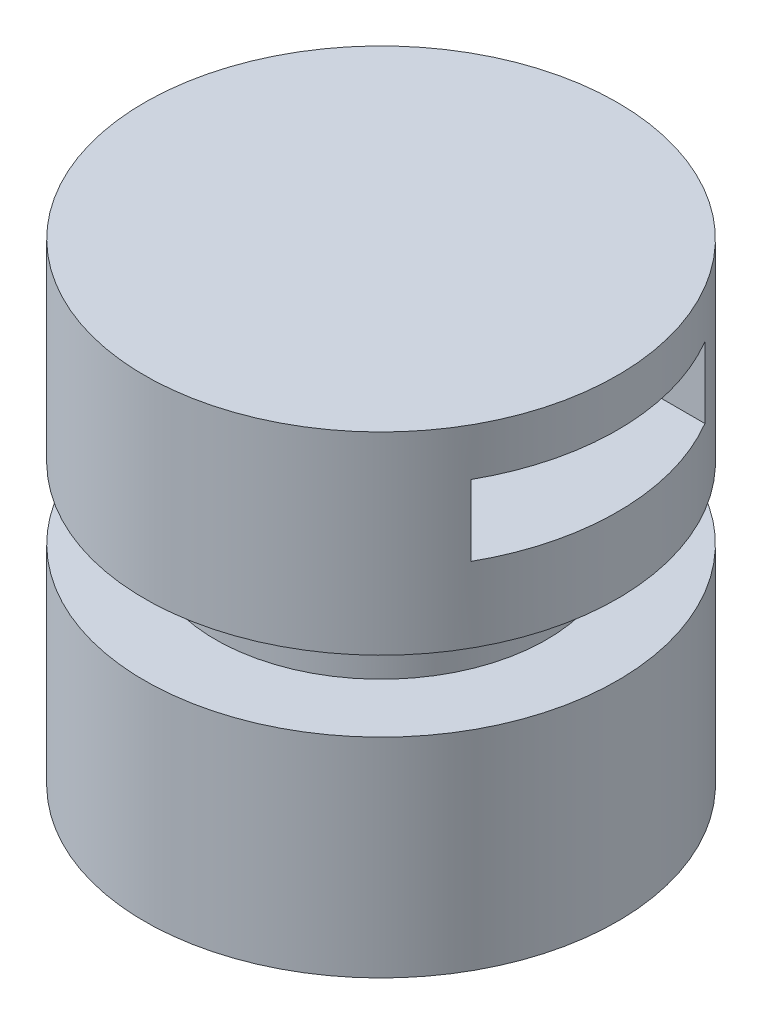
from build123d import *

# Parameters (mm, degrees)
SKETCH1_W               = 100
SKETCH1_H               = 200
SKETCH2_W               = 30
SKETCH2_H               = 30
CUT_EXTRUDE1_DEPTH      = 245.948974278
CUT_EXTRUDE1_DEPTH_BACK = 245.948974278
SKETCH4_W               = 100
SKETCH4_H               = 30


with BuildPart() as part:
    # Sketch1 → Revolve1 (revolve)
    with BuildSketch(Plane(origin=(0, 0, 0), x_dir=(0, 0, -1), z_dir=(1, 0, 0)), mode=Mode.PRIVATE) as revolve1_sk:
        with Locations((-50, 100)):
            Rectangle(SKETCH1_W, SKETCH1_H)
    revolve(revolve1_sk.sketch.rotate(Axis((0, 0, 0), (0, 1, 0)), 180), axis=Axis((0, 0, 0), (0, 1, 0)))

    # Sketch2 → Cut-Revolve1 (revolve, cut)
    with BuildSketch(Plane(origin=(0, 0, 0), x_dir=(0, 0, -1), z_dir=(1, 0, 0)), mode=Mode.PRIVATE) as cut_revolve1_sk:
        with Locations((-85, 103.220702127)):
            Rectangle(SKETCH2_W, SKETCH2_H)
    revolve(cut_revolve1_sk.sketch.rotate(Axis((0, 0, 0), (0, 1, 0)), 180), axis=Axis((0, 0, 0), (0, 1, 0)), mode=Mode.SUBTRACT)

    # Sketch4 → Cut-Extrude1 (cut, two sides: drawn at the far end of the back side and taken through both)
    with BuildSketch(Plane(origin=(0, 0, 0), x_dir=(0, 0, -1), z_dir=(1, 0, 0)).offset(-CUT_EXTRUDE1_DEPTH_BACK)):
        with Locations((0.885244984, 165)):
            Rectangle(SKETCH4_W, SKETCH4_H)
    extrude(amount=CUT_EXTRUDE1_DEPTH + CUT_EXTRUDE1_DEPTH_BACK, mode=Mode.SUBTRACT)


solid = part.part
